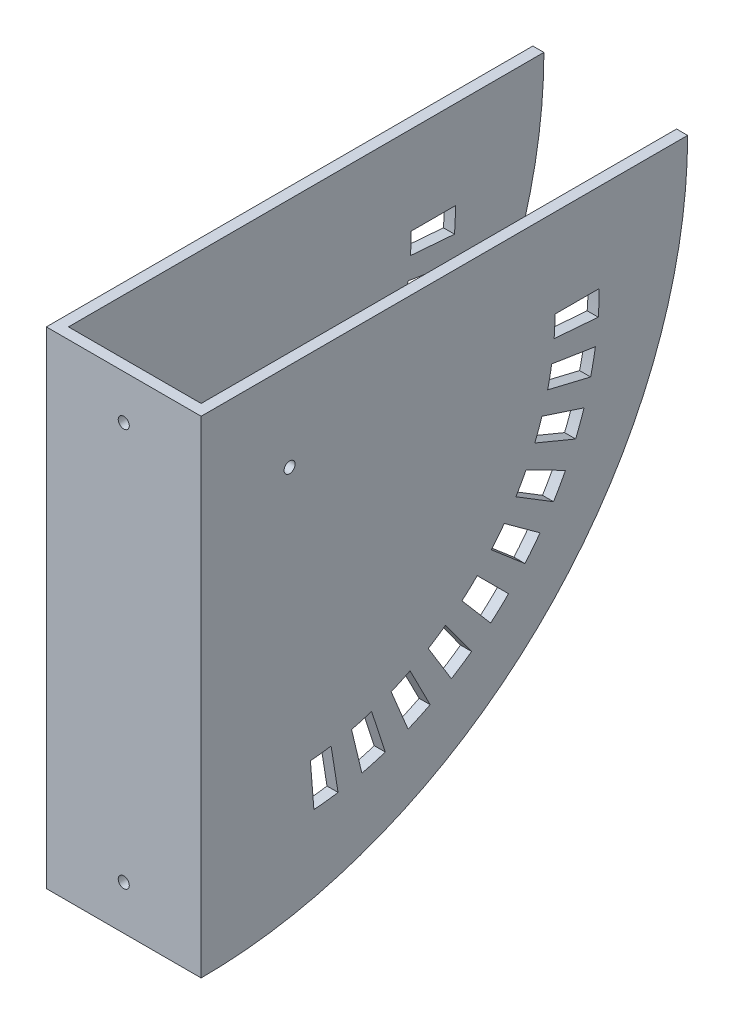
from build123d import *

# Parameters (mm, degrees)
SKETCH1_W             = 5
SKETCH1_H             = 220
BOSS_EXTRUDE1_DEPTH   = 220
BOSS_EXTRUDE1_2_DEPTH = 220
SKETCH2_W             = 60
SKETCH2_H             = 220
BOSS_EXTRUDE2_DEPTH   = 5
CUT_EXTRUDE1_DEPTH    = 110
SKETCH7_R             = 2.5
CUT_EXTRUDE6_DEPTH    = 134
SKETCH9_R             = 2.5
CUT_EXTRUDE8_DEPTH    = 134


with BuildPart() as part:
    # Sketch1 → Boss-Extrude1 (new body)
    with BuildSketch(Plane.XY):
        with Locations((32.5, 0)):
            Rectangle(SKETCH1_W, SKETCH1_H)
    extrude(amount=BOSS_EXTRUDE1_DEPTH)



with BuildPart() as body_2:
    # Sketch1 → Boss-Extrude1 2 (new body)
    with BuildSketch(Plane.XY):
        with Locations((-32.5, 0)):
            Rectangle(SKETCH1_W, SKETCH1_H)
    extrude(amount=BOSS_EXTRUDE1_2_DEPTH)


with BuildPart() as part_1:
    add(part.part)

    add(body_2.part)  # Boss-Extrude2 merges body 2
    # Sketch2 → Boss-Extrude2 (add)
    with BuildSketch(Plane.XY.offset(220)):
        Rectangle(SKETCH2_W, SKETCH2_H)
    extrude(amount=-BOSS_EXTRUDE2_DEPTH)

    # Sketch3 → Cut-Extrude1 (cut)
    with BuildSketch(Plane.ZY.offset(35)):
        with BuildLine():
            Line((0, 110), (0, -110))
            Line((0, -110), (220, -110))
            ThreePointArc((220, -110), (64.436508139, -45.563491861), (0, 110))
        make_face()
    extrude(amount=-CUT_EXTRUDE1_DEPTH, mode=Mode.SUBTRACT)

    # Sketch7 → Cut-Extrude6 (cut)
    with BuildSketch(Plane(origin=(0, 0, 215), x_dir=(-1, 0, 0), z_dir=(0, 0, -1))):
        with Locations((0, 90)):
            Circle(SKETCH7_R)
        with Locations((0, -90)):
            Circle(SKETCH7_R)
    extrude(amount=-CUT_EXTRUDE6_DEPTH, mode=Mode.SUBTRACT)

    # Sketch9 → Cut-Extrude8 (cut)
    with BuildSketch(Plane.ZY.offset(35)):
        with BuildLine():
            ThreePointArc((60.369919952, 60.584908513), (60.092515651, 65.288822109), (60, 70))
            Line((60, 70), (40, 70))
            ThreePointArc((40, 70), (40.107934926, 64.503625794), (40.431573277, 59.015726598))
            Line((40.431573277, 59.015726598), (60.369919952, 60.584908513))
        make_face()
        with BuildLine():
            ThreePointArc((63.315609552, 41.986556337), (62.305766352, 46.589161358), (61.477399129, 51.227864195))
            Line((61.477399129, 51.227864195), (41.723632317, 48.099174894))
            ThreePointArc((41.723632317, 48.099174894), (42.690060744, 42.687354918), (43.868211144, 37.31764906))
            Line((43.868211144, 37.31764906), (63.315609552, 41.986556337))
        make_face()
        with BuildLine():
            ThreePointArc((69.134456099, 24.077988116), (67.417039689, 28.465953151), (65.873218045, 32.917960675))
            Line((65.873218045, 32.917960675), (46.852087719, 26.737620788))
            ThreePointArc((46.852087719, 26.737620788), (48.653212971, 21.543612009), (50.656865448, 16.424319469))
            Line((50.656865448, 16.424319469), (69.134456099, 24.077988116))
        make_face()
        with BuildLine():
            ThreePointArc((77.683180278, 7.300172234), (75.300479151, 11.36545102), (73.079217097, 15.521140031))
            Line((73.079217097, 15.521140031), (55.259086614, 6.441330036))
            ThreePointArc((55.259086614, 6.441330036), (57.85055901, 1.59302619), (60.63037699, -3.14979906))
            Line((60.63037699, -3.14979906), (77.683180278, 7.300172234))
        make_face()
        with BuildLine():
            ThreePointArc((88.751284128, -7.9337658), (85.761968294, -4.291273917), (82.917960675, -0.534230275))
            Line((82.917960675, -0.534230275), (66.737620788, -12.289935321))
            ThreePointArc((66.737620788, -12.289935321), (70.055629677, -16.673152903), (73.543164816, -20.922726766))
            Line((73.543164816, -20.922726766), (88.751284128, -7.9337658))
        make_face()
        with BuildLine():
            ThreePointArc((102.0662342, -21.248715872), (98.543910536, -18.118701132), (95.147186258, -14.852813742))
            Line((95.147186258, -14.852813742), (81.005050634, -28.994949366))
            ThreePointArc((81.005050634, -28.994949366), (84.967895625, -32.805151321), (89.077273234, -36.456835184))
            Line((89.077273234, -36.456835184), (102.0662342, -21.248715872))
        make_face()
        with BuildLine():
            ThreePointArc((117.300172234, -32.316819722), (113.331572038, -29.776353476), (109.465769725, -27.082039325))
            Line((109.465769725, -27.082039325), (97.710064679, -43.262379212))
            ThreePointArc((97.710064679, -43.262379212), (102.220167377, -46.405745722), (106.85020094, -49.36962301))
            Line((106.85020094, -49.36962301), (117.300172234, -32.316819722))
        make_face()
        with BuildLine():
            ThreePointArc((134.077988116, -40.865543901), (129.760831496, -38.977180859), (125.521140031, -36.920782903))
            Line((125.521140031, -36.920782903), (116.441330036, -54.740913386))
            ThreePointArc((116.441330036, -54.740913386), (121.387636745, -57.140044336), (126.424319469, -59.343134552))
            Line((126.424319469, -59.343134552), (134.077988116, -40.865543901))
        make_face()
        with BuildLine():
            ThreePointArc((151.986556337, -46.684390448), (147.427146016, -45.494628374), (142.917960675, -44.126781955))
            Line((142.917960675, -44.126781955), (136.737620788, -63.147912281))
            ThreePointArc((136.737620788, -63.147912281), (141.998337019, -64.743733104), (147.31764906, -66.131788856))
            Line((147.31764906, -66.131788856), (151.986556337, -46.684390448))
        make_face()
        with BuildLine():
            ThreePointArc((170.584908513, -49.630080048), (165.895512305, -49.168214835), (161.227864195, -48.522600871))
            Line((161.227864195, -48.522600871), (158.099174894, -68.276367683))
            ThreePointArc((158.099174894, -68.276367683), (163.544764356, -69.029583974), (169.015726598, -69.568426723))
            Line((169.015726598, -69.568426723), (170.584908513, -49.630080048))
        make_face()
        with Locations((180, 70)):
            Circle(SKETCH9_R)
    extrude(amount=-CUT_EXTRUDE8_DEPTH, mode=Mode.SUBTRACT)


solid = part_1.part
